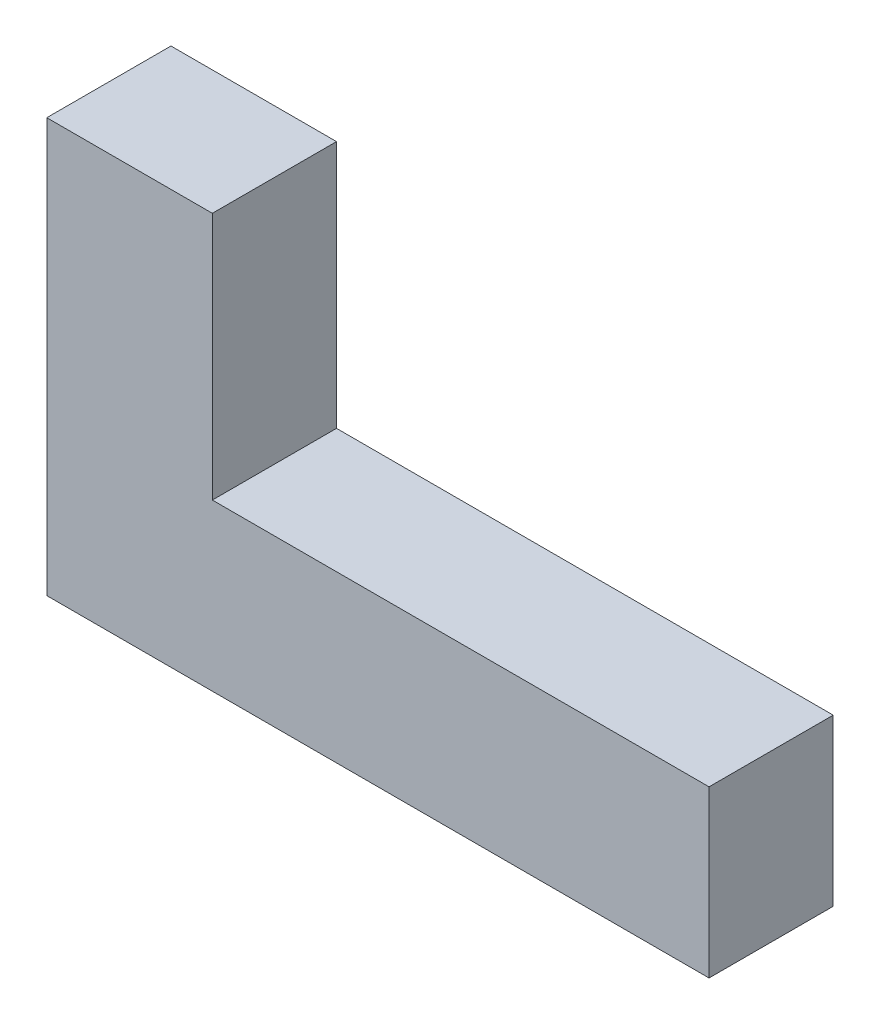
from build123d import *

# Parameters (mm, degrees)
BOSS_EXTRUDE1_DEPTH = 15


with BuildPart() as part:
    # Sketch4 → Boss-Extrude1 (new body)
    with BuildSketch(Plane.XY):
        Polygon((0, 0), (0, 50), (20, 50), (20, 20), (80, 20), (80, 0), align=None)
    extrude(amount=BOSS_EXTRUDE1_DEPTH)


solid = part.part
